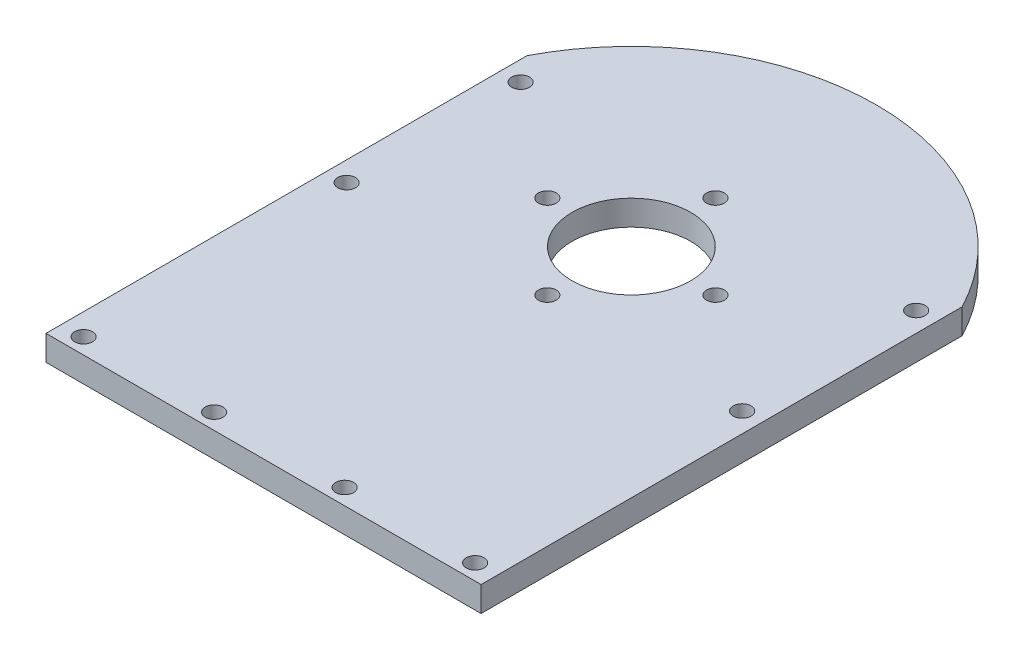
from build123d import *

# Parameters (mm, degrees)
SKETCH1_R           = 2.25
BOSS_EXTRUDE1_DEPTH = 6.35
SKETCH2_R           = 15
CUT_EXTRUDE1_DEPTH  = 10
CUT_EXTRUDE2_DEPTH  = 60
SKETCH4_R           = 2.25
CUT_EXTRUDE3_DEPTH  = 10


with BuildPart() as part:
    # Sketch1 → Boss-Extrude1 (new body)
    with BuildSketch(Plane(origin=(0, 0, 0), x_dir=(1, 0, 0), z_dir=(0, 1, 0))):
        Polygon((-5, -16), (-5, 84), (105, 84), (105, -16), (105, -71), (-5, -71), align=None)
        with Locations(Location((0, 0, 0), (0, 0, 270))):
            Circle(SKETCH1_R, mode=Mode.SUBTRACT)
        with Locations(Location((0, 44, 0), (0, 0, 270))):
            Circle(SKETCH1_R, mode=Mode.SUBTRACT)
        with Locations(Location((100, 44, 0), (0, 0, 270))):
            Circle(SKETCH1_R, mode=Mode.SUBTRACT)
        with Locations(Location((100, 0, 0), (0, 0, 270))):
            Circle(SKETCH1_R, mode=Mode.SUBTRACT)
        with Locations(Location((50, 43.25, 0), (0, 0, 270))):
            Circle(SKETCH1_R, mode=Mode.SUBTRACT)
        with Locations(Location((71.25, 22, 0), (0, 0, 270))):
            Circle(SKETCH1_R, mode=Mode.SUBTRACT)
        with Locations(Location((50, 0.75, 0), (0, 0, 270))):
            Circle(SKETCH1_R, mode=Mode.SUBTRACT)
        with Locations(Location((28.75, 22, 0), (0, 0, 270))):
            Circle(SKETCH1_R, mode=Mode.SUBTRACT)
    extrude(amount=BOSS_EXTRUDE1_DEPTH)

    # Sketch2 → Cut-Extrude1 (cut)
    with BuildSketch(Plane(origin=(0, 6.35, 0), x_dir=(1, 0, 0), z_dir=(0, 1, 0))):
        with Locations(Location((50, 22, 0), (0, 0, 270))):
            Circle(SKETCH2_R)
    extrude(amount=-CUT_EXTRUDE1_DEPTH, mode=Mode.SUBTRACT)

    # Sketch3 → Cut-Extrude2 (cut)
    with BuildSketch(Plane(origin=(0, 6.35, 0), x_dir=(1, 0, 0), z_dir=(0, 1, 0))):
        with BuildLine():
            Line((-11.87928751, 18.13298859), (-19.122468025, 134.037184903))
            Line((-19.122468025, 134.037184903), (176.364402691, 135.714155607))
            Line((176.364402691, 135.714155607), (111.227525883, 31.756540076))
            ThreePointArc((111.227525883, 31.756540076), (43.180433513, 83.623806381), (-11.87928751, 18.13298859))
        make_face()
    extrude(amount=-CUT_EXTRUDE2_DEPTH, mode=Mode.SUBTRACT)

    # Sketch4 → Cut-Extrude3 (cut)
    with BuildSketch(Plane.XZ):
        with Locations(Location((99.5, 67, 0), (0, 0, 270))):
            Circle(SKETCH4_R)
        with Locations(Location((0.5, 67, 0), (0, 0, 270))):
            Circle(SKETCH4_R)
        with Locations(Location((33.5, 67, 0), (0, 0, 270))):
            Circle(SKETCH4_R)
        with Locations(Location((66.5, 67, 0), (0, 0, 270))):
            Circle(SKETCH4_R)
    extrude(amount=-CUT_EXTRUDE3_DEPTH, mode=Mode.SUBTRACT)


solid = part.part
